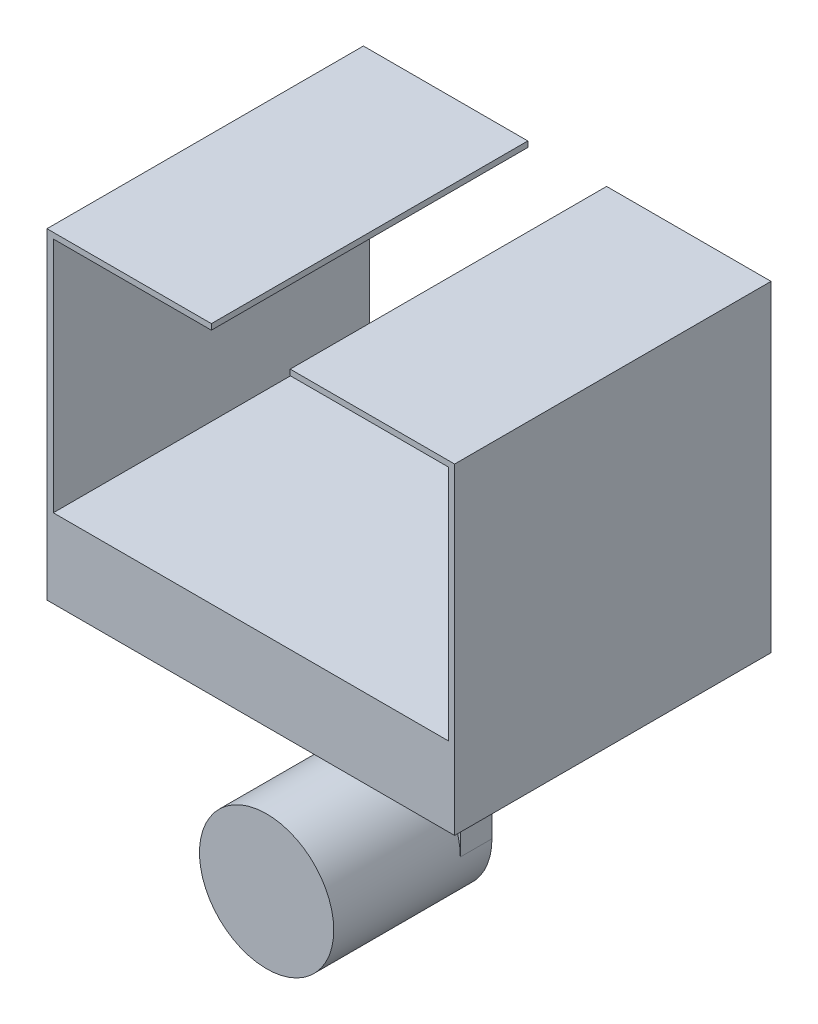
from build123d import *

# Parameters (mm, degrees)
SKETCH1_R           = 10.777569686
BOSS_EXTRUDE1_DEPTH = 25.4
SKETCH2_W           = 21.555139372
SKETCH2_H           = 25.4
BOSS_EXTRUDE2_DEPTH = 5.08
SKETCH6_W           = 65.44191557
SKETCH6_H           = 50.8
BOSS_EXTRUDE3_DEPTH = 51.639420176
SKETCH7_W           = 63.40856
SKETCH7_H           = 38.0746
CUT_EXTRUDE1_DEPTH  = 98.910026756
SKETCH8_W           = 12.6492
SKETCH8_H           = 0.915620176
CUT_EXTRUDE2_DEPTH  = 98.910026756


with BuildPart() as part:
    # Sketch1 → Boss-Extrude1 (new body)
    with BuildSketch(Plane.XY):
        Circle(SKETCH1_R)
    extrude(amount=-BOSS_EXTRUDE1_DEPTH)

    # Sketch2 → Boss-Extrude2 (add)
    with BuildSketch(Plane(origin=(0, 0, -25.4), x_dir=(-1, 0, 0), z_dir=(0, 0, -1))):
        with Locations((0, 12.7)):
            Rectangle(SKETCH2_W, SKETCH2_H)
    extrude(amount=-BOSS_EXTRUDE2_DEPTH)

    # Sketch6 → Boss-Extrude3 (add)
    with BuildSketch(Plane(origin=(0, 25.4, 0), x_dir=(1, 0, 0), z_dir=(0, 1, 0))):
        with Locations((0, 22.86)):
            Rectangle(SKETCH6_W, SKETCH6_H)
    extrude(amount=BOSS_EXTRUDE3_DEPTH)

    # Sketch7 → Cut-Extrude1 (cut, through all)
    with BuildSketch(Plane.XY.offset(2.54)):
        with Locations((0, 57.0865)):
            Rectangle(SKETCH7_W, SKETCH7_H)
    extrude(amount=-CUT_EXTRUDE1_DEPTH, mode=Mode.SUBTRACT)

    # Sketch8 → Cut-Extrude2 (cut, through all)
    with BuildSketch(Plane.XY.offset(2.54)):
        with Locations((0, 76.581610088)):
            Rectangle(SKETCH8_W, SKETCH8_H)
    extrude(amount=-CUT_EXTRUDE2_DEPTH, mode=Mode.SUBTRACT)


solid = part.part
